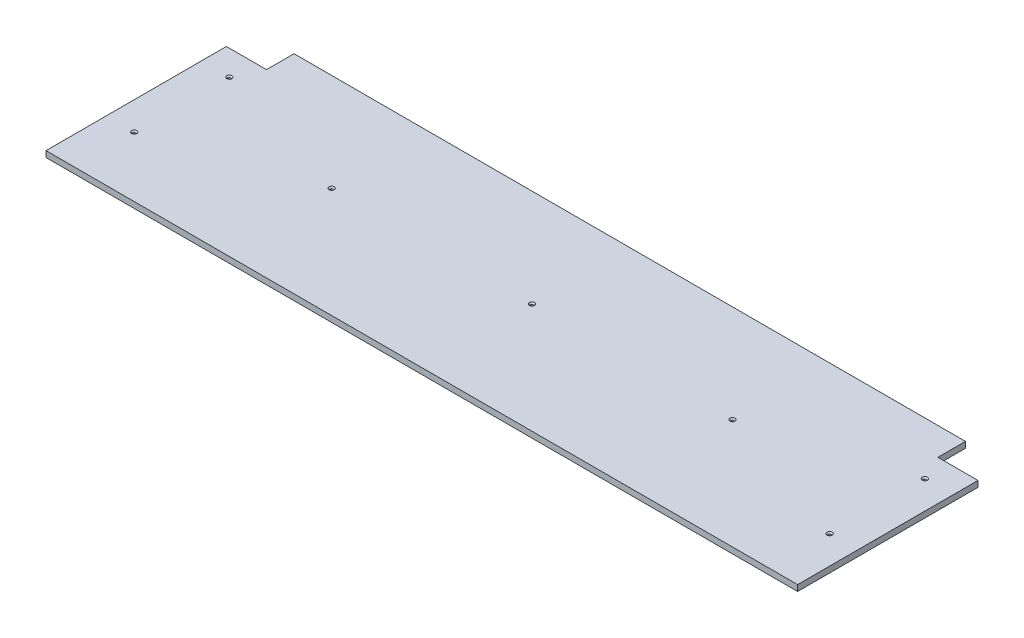
from build123d import *

# Parameters (mm, degrees)
SKETCH1_W                                       = 1500
SKETCH1_H                                       = 415
RAWMATERIAL_DEPTH                               = 12
CSK_FOR_M5_FLAT_HEAD_MACHINE_SCREW1_D           = 5.2
CSK_FOR_M5_FLAT_HEAD_MACHINE_SCREW1_CSINK_D     = 10.4
CSK_FOR_M5_FLAT_HEAD_MACHINE_SCREW1_CSINK_ANGLE = 90
SKETCH5_W                                       = 80
SKETCH5_H                                       = 55
FRAME_SLOTS_DEPTH                               = 779.267466878


with BuildPart() as part:
    # Sketch1 → RawMaterial (new body)
    with BuildSketch(Plane(origin=(0, 0, 0), x_dir=(1, 0, 0), z_dir=(0, 1, 0))):
        Rectangle(SKETCH1_W, SKETCH1_H)
    extrude(amount=RAWMATERIAL_DEPTH)

    # CSK for M5 Flat Head Machine Screw1 (through all)
    with Locations(Plane(origin=(0, 12, 0), x_dir=(-1, 0, 0), z_dir=(0, 1, 0))):
        with Locations((-694, -102.5), (-694, 87.5), (-400, -12.5), (400, -12.5), (694, 87.5), (694, -102.5), (0, -12.5)):
            CounterSinkHole(CSK_FOR_M5_FLAT_HEAD_MACHINE_SCREW1_D / 2, CSK_FOR_M5_FLAT_HEAD_MACHINE_SCREW1_CSINK_D / 2, counter_sink_angle=CSK_FOR_M5_FLAT_HEAD_MACHINE_SCREW1_CSINK_ANGLE)

    # Sketch5 → Frame Slots (cut, through all)
    with BuildSketch(Plane.XZ):
        with Locations((-710, -180)):
            Rectangle(SKETCH5_W, SKETCH5_H)
        with Locations((710, -180)):
            Rectangle(SKETCH5_W, SKETCH5_H)
    extrude(amount=-FRAME_SLOTS_DEPTH, mode=Mode.SUBTRACT)


solid = part.part
